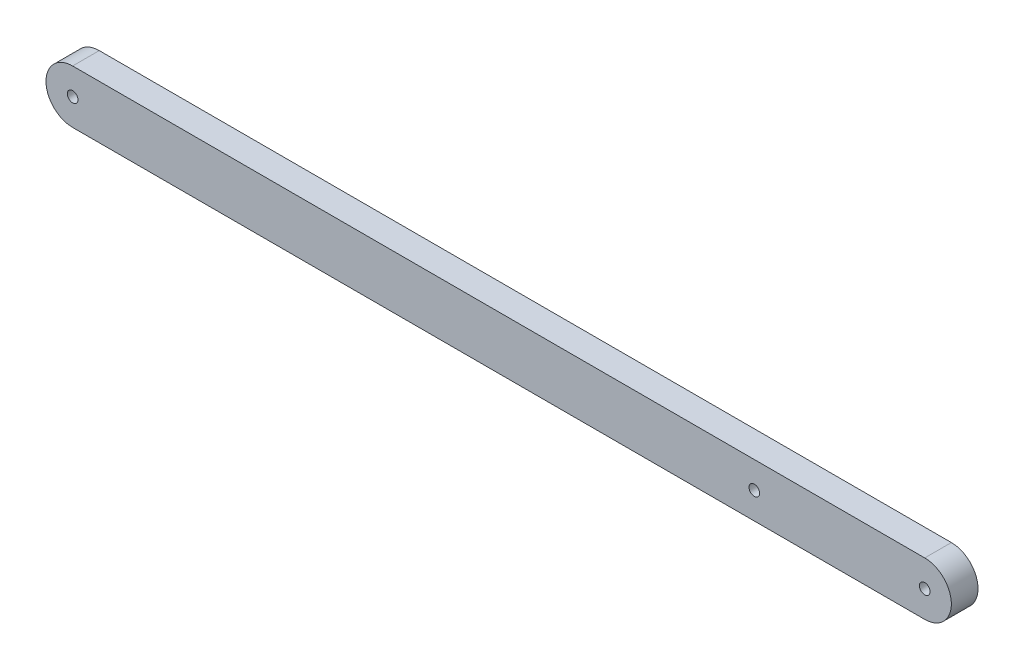
from build123d import *

# Parameters (mm, degrees)
SKETCH1_R           = 2
BOSS_EXTRUDE1_DEPTH = 10


with BuildPart() as part:
    # Sketch1 → Boss-Extrude1 (new body)
    with BuildSketch(Plane.XY):
        with BuildLine():
            Line((126.767169179, -2.495812395), (-193.232830821, -2.495812395))
            ThreePointArc((-193.232830821, -2.495812395), (-203.232830821, 7.504187605), (-193.232830821, 17.504187605))
            Line((-193.232830821, 17.504187605), (126.767169179, 17.504187605))
            ThreePointArc((126.767169179, 17.504187605), (136.767169179, 7.504187605), (126.767169179, -2.495812395))
        make_face()
        with Locations((-193.232830821, 7.504187605)):
            Circle(SKETCH1_R, mode=Mode.SUBTRACT)
        with Locations((126.767169179, 7.504187605)):
            Circle(SKETCH1_R, mode=Mode.SUBTRACT)
        with Locations((62.767169179, 7.504187605)):
            Circle(SKETCH1_R, mode=Mode.SUBTRACT)
    extrude(amount=BOSS_EXTRUDE1_DEPTH)


solid = part.part
